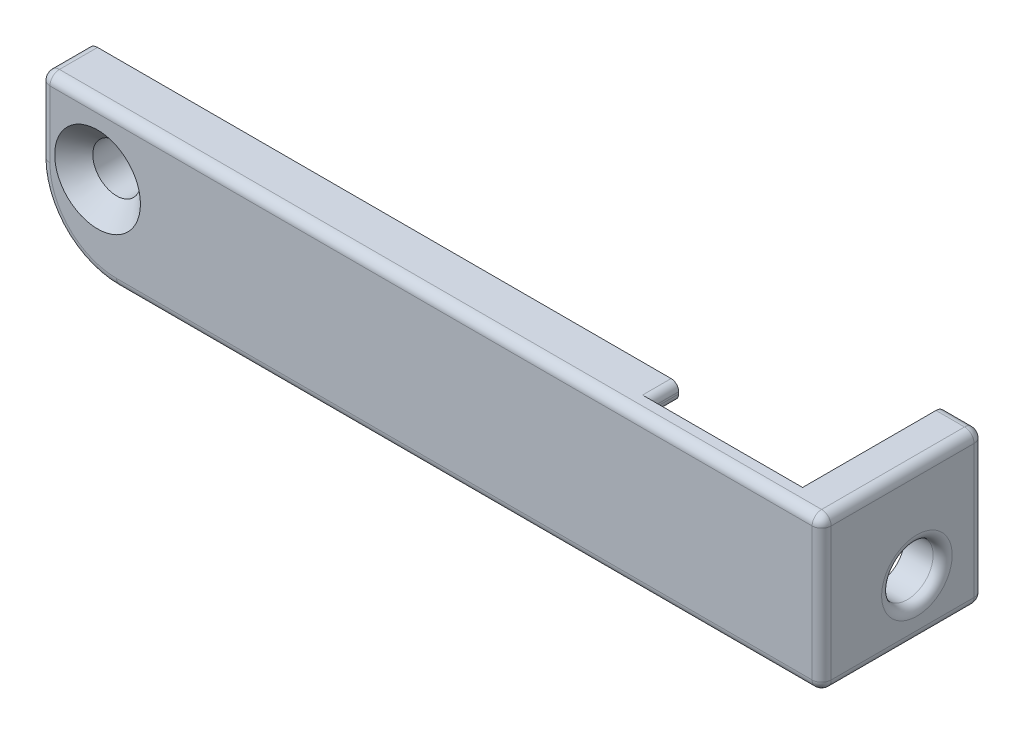
from build123d import *

# Parameters (mm, degrees)
SKETCH_1_W                = 39
SKETCH_1_H                = 8
EXTRUDE_1_DEPTH           = 1
SKETCH_3_W                = 39
SKETCH_3_H                = 0.9
EXTRUDE_3_DEPTH           = 1.5
SKETCH_4_W                = 39
SKETCH_4_H                = 0.9
EXTRUDE_4_DEPTH           = 1.5
FILLET_1_R                = 4
SKETCH_5_W                = 8.5
SKETCH_5_H                = 8
EXTRUDE_5_DEPTH           = 2
SKETCH_6_W                = 8
SKETCH_6_H                = 0.9
CUT_EXTRUDE_1_DEPTH       = 1.5
FILLET_2_R                = 0.5
SKETCH_8_R                = 1.35
CUT_EXTRUDE_2_DEPTH       = 3
FILLET_3_R                = 0.5
SKETCH_9_R                = 1.1
CUT_EXTRUDE_3_DEPTH       = 3
HOLE_WIZARD_1_D           = 2.2
HOLE_WIZARD_1_DEPTH       = 7
HOLE_WIZARD_1_CSINK_D     = 4.5
HOLE_WIZARD_1_CSINK_ANGLE = 90
HOLE_WIZARD_1_TIP         = 0.660946681
EXTRUDE_6_REACH           = 24.677
SKETCH_11_R               = 1.25
FILLET_4_R                = 0.5
FILLET_5_R                = 0.5
FILLET_6_R                = 0.4
FILLET_7_R                = 0.5


with BuildPart() as part:
    # 草图1 → 凸台-拉伸1 (new body)
    with BuildSketch(Plane.XY):
        Rectangle(SKETCH_1_W, SKETCH_1_H)
    extrude(amount=EXTRUDE_1_DEPTH)

    # 草图3 → 凸台-拉伸3 (add)
    with BuildSketch(Plane(origin=(0, 0, 0), x_dir=(-1, 0, 0), z_dir=(0, 0, -1))):
        with Locations((0, -3.55)):
            Rectangle(SKETCH_3_W, SKETCH_3_H)
    extrude(amount=EXTRUDE_3_DEPTH)

    # 草图4 → 凸台-拉伸4 (add)
    with BuildSketch(Plane(origin=(0, 0, 0), x_dir=(-1, 0, 0), z_dir=(0, 0, -1))):
        with Locations((0, 3.55)):
            Rectangle(SKETCH_4_W, SKETCH_4_H)
    extrude(amount=EXTRUDE_4_DEPTH)

    # 圆角1
    fillet_1_edges = [part.edges().sort_by_distance(p)[0] for p in [
        (-19.5, -4, -0.25),
    ]]
    fillet(fillet_1_edges, radius=FILLET_1_R)

    # 草图5 → 凸台-拉伸5 (add)
    with BuildSketch(Plane(origin=(19.5, 0, 0), x_dir=(0, 0, -1), z_dir=(1, 0, 0))):
        with Locations((3.25, 0)):
            Rectangle(SKETCH_5_W, SKETCH_5_H)
    extrude(amount=EXTRUDE_5_DEPTH)

    # 草图6 → 切除-拉伸1 (cut)
    with BuildSketch(Plane(origin=(0, 0, -1.5), x_dir=(-1, 0, 0), z_dir=(0, 0, -1))):
        with Locations((-15.5, 3.55)):
            Rectangle(SKETCH_6_W, SKETCH_6_H)
    extrude(amount=-CUT_EXTRUDE_1_DEPTH, mode=Mode.SUBTRACT)

    # 圆角2
    fillet_2_edges = [part.edges().sort_by_distance(p)[0] for p in [
        (-19.5, 2, 1),
        (-18.328427125, -2.828427125, 1),
        (1, 4, 1),
        (3, -4, 1),
        (-19.5, 4, -0.25),
    ]]
    fillet(fillet_2_edges, radius=FILLET_2_R)

    # 草图8 → 切除-拉伸2 (cut)
    with BuildSketch(Plane(origin=(21.5, 0, 0), x_dir=(0, 0, -1), z_dir=(1, 0, 0))):
        with Locations((4, -1)):
            Circle(SKETCH_8_R)
    extrude(amount=-CUT_EXTRUDE_2_DEPTH, mode=Mode.SUBTRACT)

    # 圆角3
    fillet_3_edges = [part.edges().sort_by_distance(p)[0] for p in [
        (20.5, -4, -7.5),
        (20.5, 4, -7.5),
    ]]
    fillet(fillet_3_edges, radius=FILLET_3_R)

    # 草图9 → 切除-拉伸3 (cut)
    with BuildSketch(Plane(origin=(0, 0, 0), x_dir=(-1, 0, 0), z_dir=(0, 0, -1))):
        with Locations((16.5, 0.5)):
            Circle(SKETCH_9_R)
    extrude(amount=-CUT_EXTRUDE_3_DEPTH, mode=Mode.SUBTRACT)

    # 打孔尺寸(%根据)开槽沉头木螺钉的类型1
    with Locations(Plane(origin=(-16.5, 0.5, 1), x_dir=(1, 0, 0), z_dir=(0, 0, 1))):
        with Locations((0, 0)):
            CounterSinkHole(HOLE_WIZARD_1_D / 2, HOLE_WIZARD_1_CSINK_D / 2, depth=HOLE_WIZARD_1_DEPTH, counter_sink_angle=HOLE_WIZARD_1_CSINK_ANGLE)
            with Locations((0, 0, -(HOLE_WIZARD_1_DEPTH + HOLE_WIZARD_1_TIP / 2))):  # 118° drill point
                Cone(0, HOLE_WIZARD_1_D / 2, HOLE_WIZARD_1_TIP, mode=Mode.SUBTRACT)

    # 凸台-拉伸6: up to this face of the body (flat: up to its plane)
    extrude_6_end = Plane(part.part.faces().sort_by_distance((0.902646765, 0.108678474, 0))[0])
    # 草图11 → 凸台-拉伸6 (add, up to the picked face)
    with BuildSketch(Plane(origin=(0, 0, -1.5), x_dir=(-1, 0, 0), z_dir=(0, 0, -1)), mode=Mode.PRIVATE) as extrude_6_sk1:
        with BuildLine():
            Line((15, 3.1), (15, -3.1))
            Line((15, -3.1), (18.027844932, -3.1))
            ThreePointArc((18.027844932, -3.1), (19.113265817, -1.715899221), (19.5, 0))
            Line((19.5, 0), (19.5, 3.1))
            Line((19.5, 3.1), (15, 3.1))
        make_face()
        with Locations((16.5, 0.5)):
            Circle(SKETCH_11_R, mode=Mode.SUBTRACT)
    extrude_6_tool1 = split(extrude(extrude_6_sk1.sketch, amount=-EXTRUDE_6_REACH, mode=Mode.PRIVATE), bisect_by=extrude_6_end, keep=Keep.BOTH, mode=Mode.PRIVATE)
    add(extrude_6_tool1.solids().sort_by(Axis((-19.423391, 1.55, -1.5), (0, 0, 1)))[0])

    # 圆角4
    fillet_4_edges = [part.edges().sort_by_distance(p)[0] for p in [
        (-15, -3.1, -0.75),
        (-15, 3.1, -0.75),
    ]]
    fillet(fillet_4_edges, radius=FILLET_4_R)

    # 圆角5
    fillet_5_edges = [part.edges().sort_by_distance(p)[0] for p in [
        (19.5, -3.1, -0.75),
    ]]
    fillet(fillet_5_edges, radius=FILLET_5_R)

    # 圆角6
    fillet_6_edges = [part.edges().sort_by_distance(p)[0] for p in [
        (11.5, 3.1, -0.75),
        (11.5, 4, -0.75),
    ]]
    fillet(fillet_6_edges, radius=FILLET_6_R)

    # 圆角7
    fillet_7_edges = [part.edges().sort_by_distance(p)[0] for p in [
        (21.5, -1, -2.65),
        (21.5, 0, -7.5),
        (21.5, -3.853553391, -7.353553391),
        (21.5, 3.853553391, -7.353553391),
        (21.5, 0, 1),
        (21.5, 4, -3.25),
        (21.5, -4, -3.25),
        (21.5, -3.853553391, 0.853553391),
        (21.5, 3.853553391, 0.853553391),
    ]]
    fillet(fillet_7_edges, radius=FILLET_7_R)


solid = part.part
